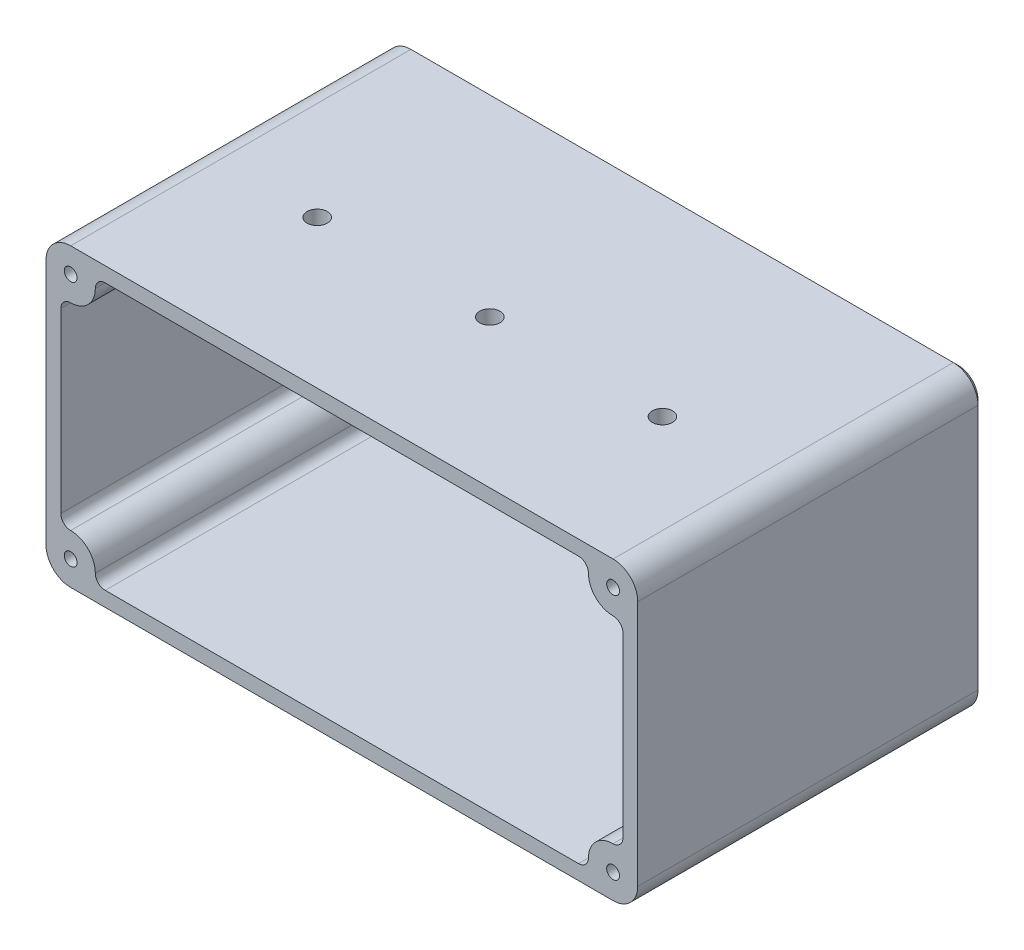
from build123d import *

# Parameters (mm, degrees)
SKETCH1_W           = 120
SKETCH1_H           = 60
BOSS_EXTRUDE1_DEPTH = 70
SKETCH2_W           = 114
SKETCH2_H           = 54
CUT_EXTRUDE1_DEPTH  = 67
FILLET3_R           = 5
FILLET4_R           = 2
SKETCH4_R           = 5
BOSS_EXTRUDE3_DEPTH = 67
FILLET5_R           = 2
SKETCH5_R           = 1.3
CUT_EXTRUDE2_DEPTH  = 18
SKETCH6_R           = 2.05
CUT_EXTRUDE3_DEPTH  = 3
CHAMFER2_SIZE       = 1
SKETCH7_R           = 6.25
CUT_EXTRUDE4_DEPTH  = 97.953597148
SKETCH8_R           = 8.75
CUT_EXTRUDE5_DEPTH  = 1.5


with BuildPart() as part:
    # Sketch1 → Boss-Extrude1 (new body)
    with BuildSketch(Plane.XY):
        Rectangle(SKETCH1_W, SKETCH1_H)
    extrude(amount=BOSS_EXTRUDE1_DEPTH)

    # Sketch2 → Cut-Extrude1 (cut)
    with BuildSketch(Plane.XY.offset(70)):
        Rectangle(SKETCH2_W, SKETCH2_H)
    extrude(amount=-CUT_EXTRUDE1_DEPTH, mode=Mode.SUBTRACT)

    # Fillet3
    fillet3_edges = [part.edges().sort_by_distance(p)[0] for p in [
        (60, -30, 35),
        (-60, -30, 35),
        (-60, 30, 35),
        (60, 30, 35),
    ]]
    fillet(fillet3_edges, radius=FILLET3_R)

    # Fillet4
    fillet4_edges = [part.edges().sort_by_distance(p)[0] for p in [
        (57, 27, 36.5),
        (57, -27, 36.5),
        (-57, -27, 36.5),
        (-57, 27, 36.5),
    ]]
    fillet(fillet4_edges, radius=FILLET4_R)

    # Sketch4 → Boss-Extrude3 (add)
    with BuildSketch(Plane.XY.offset(70)):
        with Locations((-55, 25)):
            Circle(SKETCH4_R)
        with Locations((55, 25)):
            Circle(SKETCH4_R)
        with Locations((55, -25)):
            Circle(SKETCH4_R)
        with Locations((-55, -25)):
            Circle(SKETCH4_R)
    extrude(amount=-BOSS_EXTRUDE3_DEPTH)

    # Fillet5
    fillet5_edges = [part.edges().sort_by_distance(p)[0] for p in [
        (-50.417424305, -27, 36.5),
        (-57, -20.417424305, 36.5),
        (57, -20.417424305, 36.5),
        (50.417424305, -27, 36.5),
        (50.417424305, 27, 36.5),
        (57, 20.417424305, 36.5),
        (-57, 20.417424305, 36.5),
        (-50.417424305, 27, 36.5),
    ]]
    fillet(fillet5_edges, radius=FILLET5_R)

    # Sketch5 → Cut-Extrude2 (cut)
    with BuildSketch(Plane.XY.offset(70)):
        with Locations((-55, 25)):
            Circle(SKETCH5_R)
        with Locations((55, 25)):
            Circle(SKETCH5_R)
        with Locations((55, -25)):
            Circle(SKETCH5_R)
        with Locations((-55, -25)):
            Circle(SKETCH5_R)
    extrude(amount=-CUT_EXTRUDE2_DEPTH, mode=Mode.SUBTRACT)

    # Sketch6 → Cut-Extrude3 (cut)
    with BuildSketch(Plane(origin=(0, 30, 0), x_dir=(1, 0, 0), z_dir=(0, 1, 0))):
        with Locations(Location((0, -40, 0), (0, 0, 270))):
            Circle(SKETCH6_R)
        with Locations(Location((35, -40, 0), (0, 0, 270))):
            Circle(SKETCH6_R)
        with Locations(Location((-35, -40, 0), (0, 0, 270))):
            Circle(SKETCH6_R)
    extrude(amount=-CUT_EXTRUDE3_DEPTH, mode=Mode.SUBTRACT)

    # Chamfer2
    chamfer2_edges = [part.edges().sort_by_distance(p)[0] for p in [
        (0, -30, 0),
        (60, 0, 0),
        (-60, 0, 0),
        (0, 30, 0),
        (-58.535533906, 28.535533906, 0),
        (58.535533906, 28.535533906, 0),
        (58.535533906, -28.535533906, 0),
        (-58.535533906, -28.535533906, 0),
    ]]
    chamfer(chamfer2_edges, length=CHAMFER2_SIZE)

    # Sketch7 → Cut-Extrude4 (cut, through all)
    with BuildSketch(Plane(origin=(0, 0, 0), x_dir=(-1, 0, 0), z_dir=(0, 0, -1))):
        with Locations((-43, -18)):
            Circle(SKETCH7_R)
    extrude(amount=-CUT_EXTRUDE4_DEPTH, mode=Mode.SUBTRACT)

    # Sketch8 → Cut-Extrude5 (cut)
    with BuildSketch(Plane.XY.offset(3)):
        with Locations((43, -18)):
            Circle(SKETCH8_R)
    extrude(amount=-CUT_EXTRUDE5_DEPTH, mode=Mode.SUBTRACT)


solid = part.part
